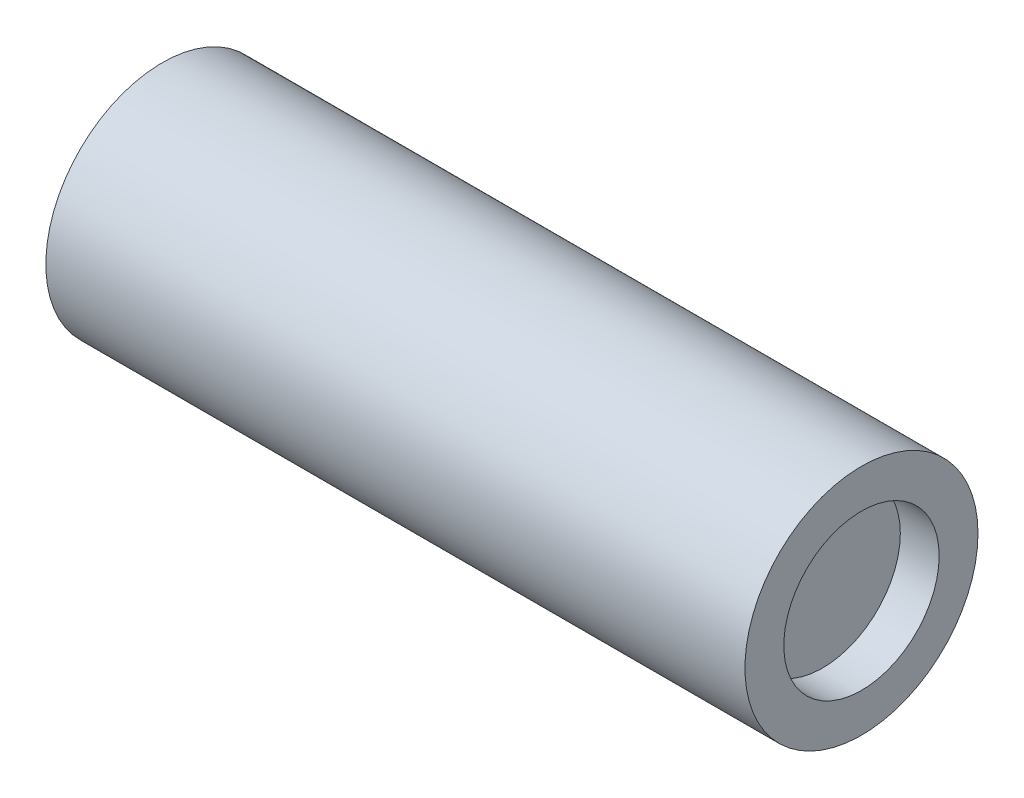
from build123d import *

# Parameters (mm, degrees)
SKETCH2_R           = 6
BOSS_EXTRUDE1_DEPTH = 36
SKETCH3_R           = 4
CUT_EXTRUDE1_DEPTH  = 2
SKETCH4_R           = 0.5
BOSS_EXTRUDE4_DEPTH = 3


with BuildPart() as part:
    # Sketch2 → Boss-Extrude1 (new body)
    with BuildSketch(Plane(origin=(0, 0, 0), x_dir=(0, 0, -1), z_dir=(1, 0, 0))):
        Circle(SKETCH2_R)
    extrude(amount=BOSS_EXTRUDE1_DEPTH)

    # Sketch3 → Cut-Extrude1 (cut)
    with BuildSketch(Plane(origin=(36, 0, 0), x_dir=(0, 0, -1), z_dir=(1, 0, 0))):
        Circle(SKETCH3_R)
    extrude(amount=-CUT_EXTRUDE1_DEPTH, mode=Mode.SUBTRACT)

    # Sketch4 → Boss-Extrude4 (add)
    with BuildSketch(Plane(origin=(0, 0, 0), x_dir=(0, 0, -1), z_dir=(1, 0, 0))):
        with Locations((0.51, 0)):
            Circle(SKETCH4_R)
        with Locations(Location((-0.51, 0, 0), (0, 0, 180))):
            Circle(SKETCH4_R)
    extrude(amount=-BOSS_EXTRUDE4_DEPTH)


solid = part.part
